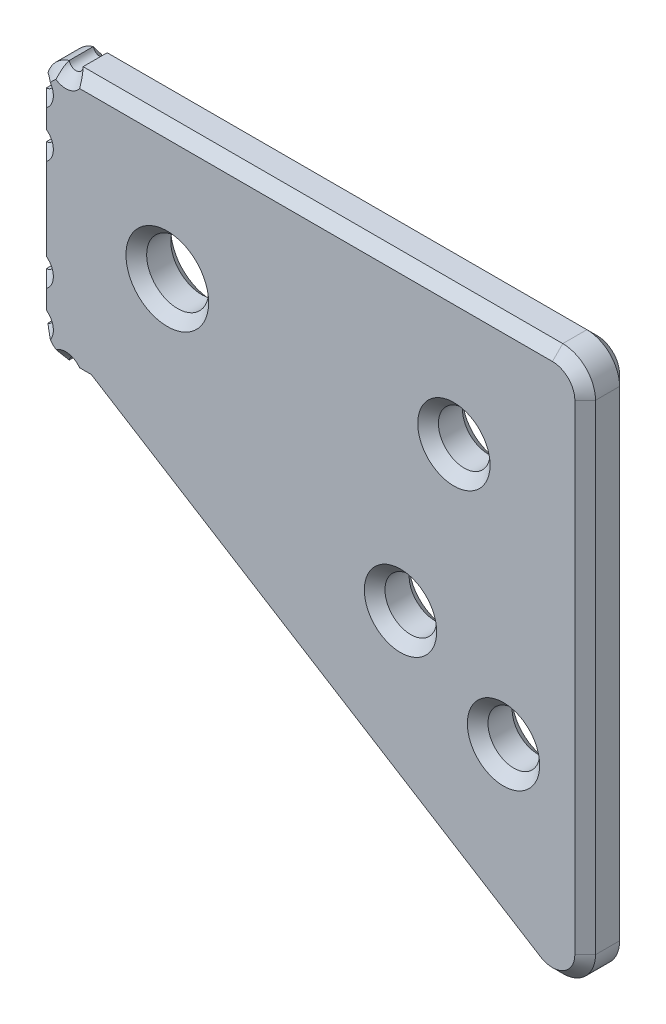
from build123d import *

# Parameters (mm, degrees)
SKETCH1_R           = 3.75
SKETCH1_R_2         = 4.5
BOSS_EXTRUDE1_DEPTH = 6.5
CHAMFER1_SIZE       = 1.5


with BuildPart() as part:
    # Sketch1 → Boss-Extrude1 (new body)
    with BuildSketch(Plane.XY):
        with BuildLine():
            Line((-11.458079381, -19.05), (53.381074139, -59.408818568))
            ThreePointArc((53.381074139, -59.408818568), (58.197626483, -59.528635467), (60.641156228, -55.376203052))
            Line((60.641156228, -55.376203052), (60.641156228, 14.3))
            ThreePointArc((60.641156228, 14.3), (59.249913439, 17.658757211), (55.891156228, 19.05))
            Line((55.891156228, 19.05), (-13.723477062, 19.05))
            ThreePointArc((-13.723477062, 19.05), (-14.628464695, 18.040083046), (-15.73121772, 18.829304583))
            ThreePointArc((-15.73121772, 18.829304583), (-17.658815789, 17.658815789), (-18.829304583, 15.73121772))
            ThreePointArc((-18.829304583, 15.73121772), (-18.040083046, 14.628464695), (-19.05, 13.723477062))
            Line((-19.05, 13.723477062), (-19.05, 8.996305235))
            ThreePointArc((-19.05, 8.996305235), (-18.034, 7.980305235), (-19.05, 6.964305235))
            Line((-19.05, 6.964305235), (-19.05, -6.964305235))
            ThreePointArc((-19.05, -6.964305235), (-18.034, -7.980305235), (-19.05, -8.996305235))
            Line((-19.05, -8.996305235), (-19.05, -13.723477062))
            ThreePointArc((-19.05, -13.723477062), (-18.040083046, -14.628464695), (-18.829304583, -15.73121772))
            ThreePointArc((-18.829304583, -15.73121772), (-17.658815789, -17.658815789), (-15.73121772, -18.829304583))
            ThreePointArc((-15.73121772, -18.829304583), (-14.628464695, -18.040083046), (-13.723477062, -19.05))
            Line((-13.723477062, -19.05), (-11.458079381, -19.05))
        make_face()
        with Locations(Location((48.789415314, -34.11185183, 0), (0, 0, 180))):
            Circle(SKETCH1_R, mode=Mode.SUBTRACT)
        with Locations(Location((33.840565899, -24.807012569, 0), (0, 0, 180))):
            Circle(SKETCH1_R, mode=Mode.SUBTRACT)
        with Locations(Location((41.591156228, 0, 0), (0, 0, 180))):
            Circle(SKETCH1_R, mode=Mode.SUBTRACT)
        with Locations(Location((0, 0, 0), (0, 0, 180))):
            Circle(SKETCH1_R_2, mode=Mode.SUBTRACT)
    extrude(amount=BOSS_EXTRUDE1_DEPTH)

    # Chamfer1
    chamfer1_edges = [part.edges().sort_by_distance(p)[0] for p in [
        (-14.628464695, -18.040083046, 6.5),
        (4.5, 0, 6.5),
        (45.341156228, 0, 6.5),
        (37.590565899, -24.807012569, 6.5),
        (52.539415314, -34.11185183, 6.5),
        (-12.590778221, -19.05, 6.5),
        (20.961497379, -39.229409284, 6.5),
        (52.539415314, -34.11185183, 0),
        (37.590565899, -24.807012569, 0),
        (58.197626483, -59.528635467, 6.5),
        (45.341156228, 0, 0),
        (4.5, 0, 0),
        (-17.658815789, -17.658815789, 0),
        (-18.040083046, -14.628464695, 0),
        (-19.05, -11.359891149, 0),
        (-18.034, -7.980305235, 0),
        (-19.05, 0, 0),
        (-18.034, 7.980305235, 0),
        (-19.05, 11.359891149, 0),
        (-18.040083046, 14.628464695, 0),
        (60.641156228, -20.538101526, 6.5),
        (-17.658815789, 17.658815789, 0),
        (-14.628464695, 18.040083046, 0),
        (21.083839583, 19.05, 0),
        (59.249913439, 17.658757211, 0),
        (60.641156228, -20.538101526, 0),
        (58.197626483, -59.528635467, 0),
        (20.961497379, -39.229409284, 0),
        (-12.590778221, -19.05, 0),
        (-14.628464695, -18.040083046, 0),
        (59.249913439, 17.658757211, 6.5),
        (21.083839583, 19.05, 6.5),
        (-14.628464695, 18.040083046, 6.5),
        (-17.658815789, 17.658815789, 6.5),
        (-18.040083046, 14.628464695, 6.5),
        (-19.05, 11.359891149, 6.5),
        (-18.034, 7.980305235, 6.5),
        (-19.05, 0, 6.5),
        (-18.034, -7.980305235, 6.5),
        (-19.05, -11.359891149, 6.5),
        (-18.040083046, -14.628464695, 6.5),
        (-17.658815789, -17.658815789, 6.5),
    ]]
    chamfer(chamfer1_edges, length=CHAMFER1_SIZE)


solid = part.part
